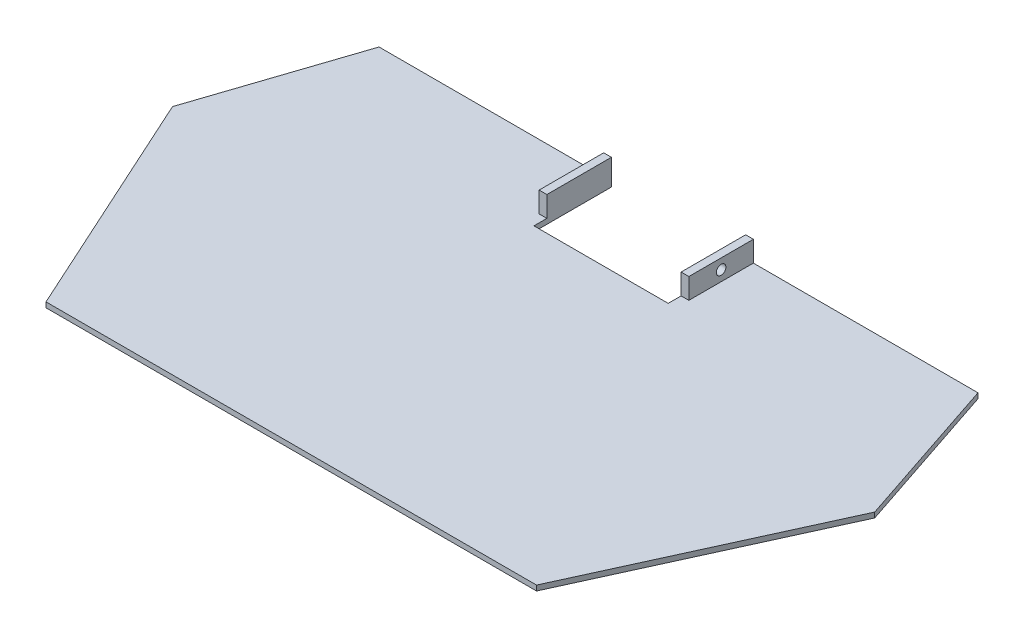
from build123d import *

# Parameters (mm, degrees)
EXTRUDE_1_DEPTH     = 2
SKETCH_2_W          = 3
SKETCH_2_H          = 25
EXTRUDE_2_DEPTH     = 8
SKETCH_3_R          = 1.85
CUT_EXTRUDE_1_DEPTH = 8


with BuildPart() as part:
    # 草图1 → 凸台-拉伸1 (new body)
    with BuildSketch(Plane(origin=(0, 0, 0), x_dir=(1, 0, 0), z_dir=(0, 1, 0))):
        Polygon((26, 30), (-26, 30), (-26, 60), (-116, 60), (-136, 0), (-95, -90), (95, -90), (136, 0), (116, 60), (26, 60), align=None)
    extrude(amount=EXTRUDE_1_DEPTH)

    # 草图2 → 凸台-拉伸2 (add)
    with BuildSketch(Plane(origin=(0, 2, 0), x_dir=(1, 0, 0), z_dir=(0, 1, 0))):
        with Locations((27.5, 47.5)):
            Rectangle(SKETCH_2_W, SKETCH_2_H)
        with Locations((-27.5, 47.5)):
            Rectangle(SKETCH_2_W, SKETCH_2_H)
    extrude(amount=EXTRUDE_2_DEPTH)

    # 草图3 → 切除-拉伸1 (cut)
    with BuildSketch(Plane.ZY.offset(-26)):
        with Locations((-47.5, 6)):
            Circle(SKETCH_3_R)
    extrude(amount=-CUT_EXTRUDE_1_DEPTH, mode=Mode.SUBTRACT)


solid = part.part
